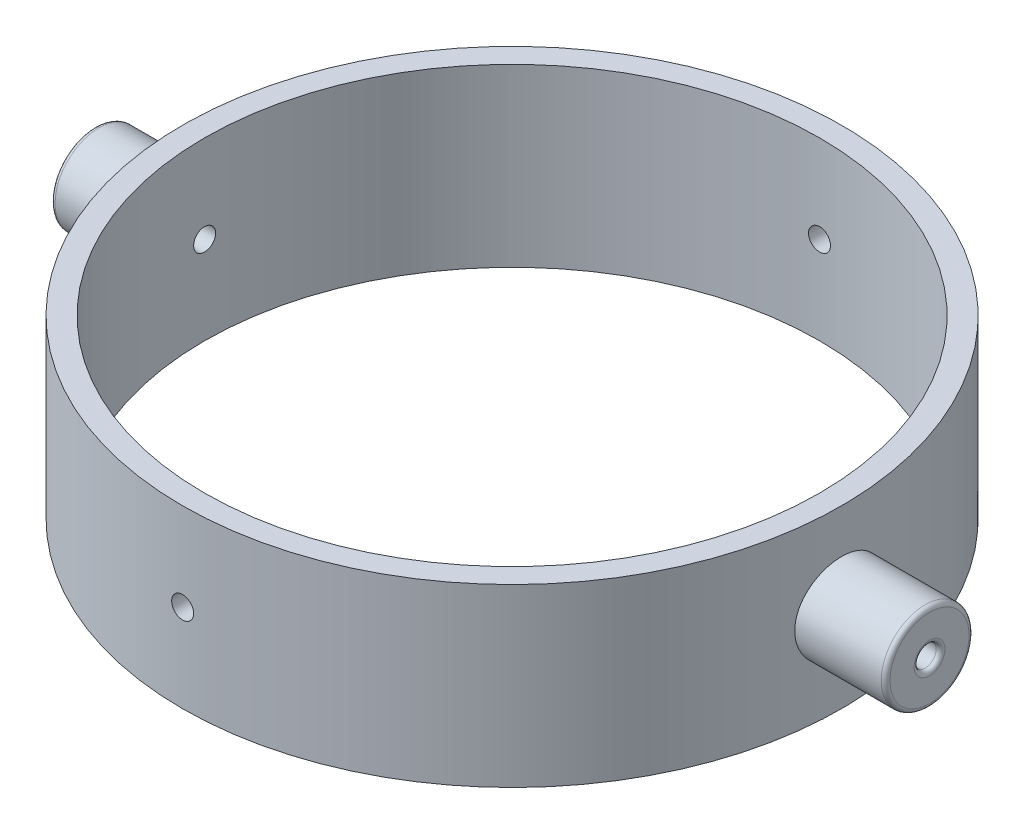
from build123d import *

# Parameters (mm, degrees)
SKETCH1_R           = 95.25
SKETCH1_R_2         = 88.9
BOSS_EXTRUDE1_DEPTH = 50.8
BOSS_EXTRUDE2_START = -0.850464
SKETCH2_R           = 12.7
BOSS_EXTRUDE2_DEPTH = 26.250464
SKETCH3_R           = 3.175
CUT_EXTRUDE1_DEPTH  = 50.8
FILLET1_R           = 1.27
SKETCH4_R           = 3.175
CUT_EXTRUDE2_DEPTH  = 10.16


with BuildPart() as part:
    # Sketch1 → Boss-Extrude1 (new body)
    with BuildSketch(Plane(origin=(0, 0, 0), x_dir=(1, 0, 0), z_dir=(0, 1, 0))):
        with Locations(Location((0, 0, 0), (0, 0, 270))):
            Circle(SKETCH1_R)
        with Locations(Location((0, 0, 0), (0, 0, 270))):
            Circle(SKETCH1_R_2, mode=Mode.SUBTRACT)
    extrude(amount=BOSS_EXTRUDE1_DEPTH)

    # Sketch2 → Boss-Extrude2 (add)
    with BuildSketch(Plane.ZY.offset(95.25).offset(BOSS_EXTRUDE2_START)):
        with Locations(Location((0, 25.4, 0), (0, 0, 180))):
            Circle(SKETCH2_R)
    boss_extrude2 = extrude(amount=BOSS_EXTRUDE2_DEPTH)

    # Sketch3 → Cut-Extrude1 (cut)
    with BuildSketch(Plane.ZY.offset(120.65)):
        with Locations((0, 25.4)):
            Circle(SKETCH3_R)
    cut_extrude1 = extrude(amount=-CUT_EXTRUDE1_DEPTH, mode=Mode.SUBTRACT)

    # Mirror1: Boss-Extrude2, Cut-Extrude1 across plane
    add(boss_extrude2.mirror(Plane(origin=(0, 0, 0), x_dir=(0, 0, 1), z_dir=(1, 0, 0))))
    add(cut_extrude1.mirror(Plane(origin=(0, 0, 0), x_dir=(0, 0, 1), z_dir=(1, 0, 0))), mode=Mode.SUBTRACT)

    # Fillet1
    fillet1_edges = [part.edges().sort_by_distance(p)[0] for p in [
        (-120.65, 25.4, 12.7),
        (-120.65, 25.4, -3.175),
        (120.65, 25.4, 12.7),
        (120.65, 25.4, -3.175),
    ]]
    fillet(fillet1_edges, radius=FILLET1_R)

    # Sketch4 → Cut-Extrude2 (cut)
    with BuildSketch(Plane(origin=(0, 0, -95.25), x_dir=(-1, 0, 0), z_dir=(0, 0, -1))):
        with Locations(Location((0, 25.4, 0), (0, 0, 90))):
            Circle(SKETCH4_R)
    cut_extrude2 = extrude(amount=-CUT_EXTRUDE2_DEPTH, mode=Mode.SUBTRACT)

    # Mirror2: Cut-Extrude2 across plane
    add(cut_extrude2.mirror(Plane.XY), mode=Mode.SUBTRACT)


solid = part.part
